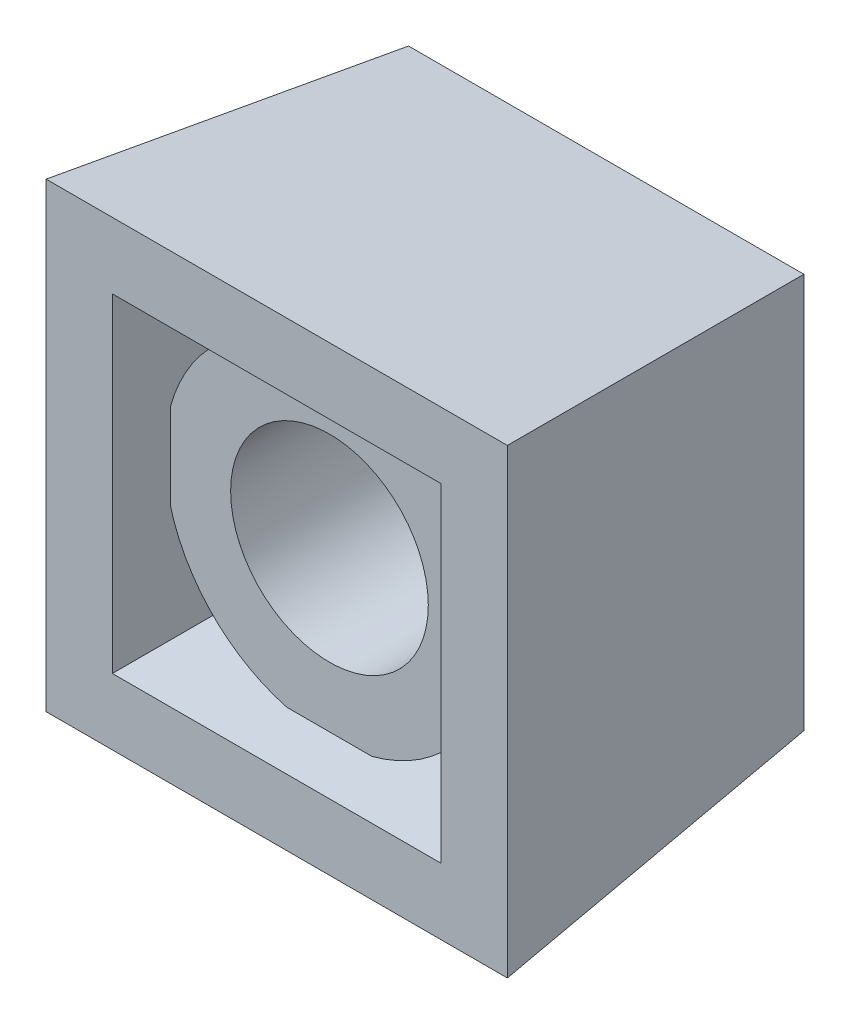
from build123d import *

# Parameters (mm, degrees)
COQUE1_T           = -1
ESQUISSE3_R        = 2.5
ESQUISSE3_R_2      = 1.5
BOSS_EXTRU_1_DEPTH = 3.2


with BuildPart() as part:
    # Esquisse2 → Lissage1 section 0
    with BuildSketch(Plane.XY.offset(5)):
        with BuildLine():
            Line((3.5, 3.5), (-3.5, 3.5))
            Line((-3.5, 3.5), (-3.5, -3.5))
            Line((-3.5, -3.5), (3.5, -3.5))
            Line((3.5, -3.5), (3.5, 3.5))
        make_face()
    # Esquisse1 → Lissage1 section 1
    with BuildSketch(Plane.XY):
        with BuildLine():
            Line((-3, 3), (3, 3))
            Line((3, 3), (3, -3))
            Line((3, -3), (-3, -3))
            Line((-3, -3), (-3, 3))
        make_face()
    loft()

    # Coque1
    coque1_openings = [part.faces().sort_by_distance(p)[0] for p in [
        (0, 0, 5),
    ]]
    offset(amount=COQUE1_T, openings=coque1_openings, kind=Kind.INTERSECTION)

    # Esquisse3 → Boss.-Extru.1 (add)
    with BuildSketch(Plane.XY.offset(1)):
        Circle(ESQUISSE3_R)
        Circle(ESQUISSE3_R_2, mode=Mode.SUBTRACT)
    extrude(amount=BOSS_EXTRU_1_DEPTH)


solid = part.part
